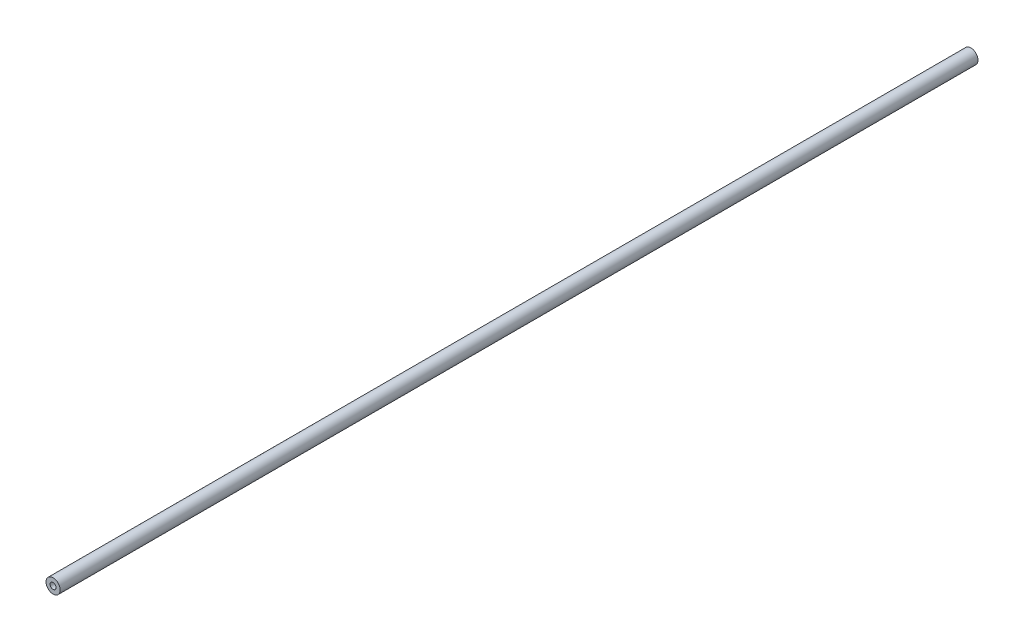
from build123d import *

# Parameters (mm, degrees)
SKETCH1_R                  = 4.7625
BOSS_EXTRUDE1_DEPTH        = 615.95
F_10_32_TAPPED_HOLE1_D     = 4.0386
F_10_32_TAPPED_HOLE1_DEPTH = 19.05
F_10_32_TAPPED_HOLE1_TIP   = 1.213317848
F_10_32_TAPPED_HOLE4_D     = 4.0386
F_10_32_TAPPED_HOLE4_DEPTH = 19.05
F_10_32_TAPPED_HOLE4_TIP   = 1.213317848


with BuildPart() as part:
    # Sketch1 → Boss-Extrude1 (new body)
    with BuildSketch(Plane.XY):
        Circle(SKETCH1_R)
    extrude(amount=-BOSS_EXTRUDE1_DEPTH)

    # #10-32 Tapped Hole1
    with Locations(Plane(origin=(0, 0, -615.95), x_dir=(-1, 0, 0), z_dir=(0, 0, -1))):
        with Locations((0, 0)):
            Hole(F_10_32_TAPPED_HOLE1_D / 2, depth=F_10_32_TAPPED_HOLE1_DEPTH)
            with Locations((0, 0, -(F_10_32_TAPPED_HOLE1_DEPTH + F_10_32_TAPPED_HOLE1_TIP / 2))):  # 118° drill point
                Cone(0, F_10_32_TAPPED_HOLE1_D / 2, F_10_32_TAPPED_HOLE1_TIP, mode=Mode.SUBTRACT)

    # #10-32 Tapped Hole4
    with Locations(Plane.XY):
        with Locations((0, 0)):
            Hole(F_10_32_TAPPED_HOLE4_D / 2, depth=F_10_32_TAPPED_HOLE4_DEPTH)
            with Locations((0, 0, -(F_10_32_TAPPED_HOLE4_DEPTH + F_10_32_TAPPED_HOLE4_TIP / 2))):  # 118° drill point
                Cone(0, F_10_32_TAPPED_HOLE4_D / 2, F_10_32_TAPPED_HOLE4_TIP, mode=Mode.SUBTRACT)


solid = part.part
